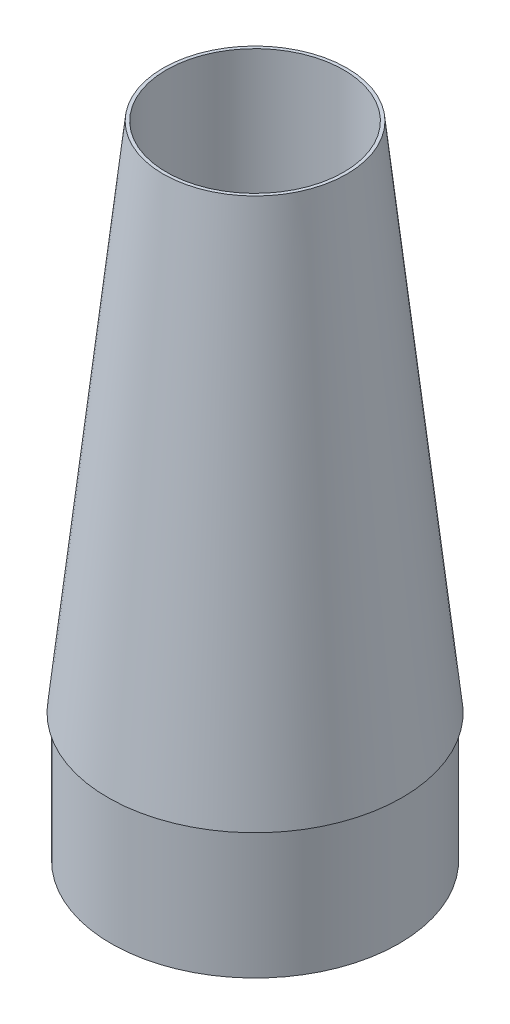
from build123d import *

# Parameters (mm, degrees)
SKETCH2_R          = 52.74818
CUT_EXTRUDE1_DEPTH = 203.2
SKETCH3_OUTSIDE_W  = 267.931
SKETCH3_OUTSIDE_H  = 267.93
SKETCH3_OUTSIDE_R  = 85.6234
CUT_EXTRUDE2_DEPTH = 76.2


with BuildPart() as part:
    # Sketch1 → Revolve1 (revolve)
    with BuildSketch(Plane.XY):
        Polygon((0, 0), (0, 76.2), (32.87522, 381), (87.5284, 381), (87.5284, 0), align=None)
    revolve(axis=Axis((87.5284, 381, 0), (0, -1, 0)))

    # Sketch2 → Cut-Extrude1 (cut)
    with BuildSketch(Plane(origin=(0, 381, 0), x_dir=(1, 0, 0), z_dir=(0, 1, 0))):
        with Locations(Location((87.5284, 0, 0), (0, 0, 180))):
            Circle(SKETCH2_R)
    extrude(amount=-CUT_EXTRUDE1_DEPTH, mode=Mode.SUBTRACT)

    # Sketch3 outside → Cut-Extrude2 (cut)
    with BuildSketch(Plane.XZ):
        with Locations((87.5285, 0)):
            Rectangle(SKETCH3_OUTSIDE_W, SKETCH3_OUTSIDE_H)
        with Locations((87.5284, 0)):
            Circle(SKETCH3_OUTSIDE_R, mode=Mode.SUBTRACT)
    extrude(amount=-CUT_EXTRUDE2_DEPTH, mode=Mode.SUBTRACT)


solid = part.part
